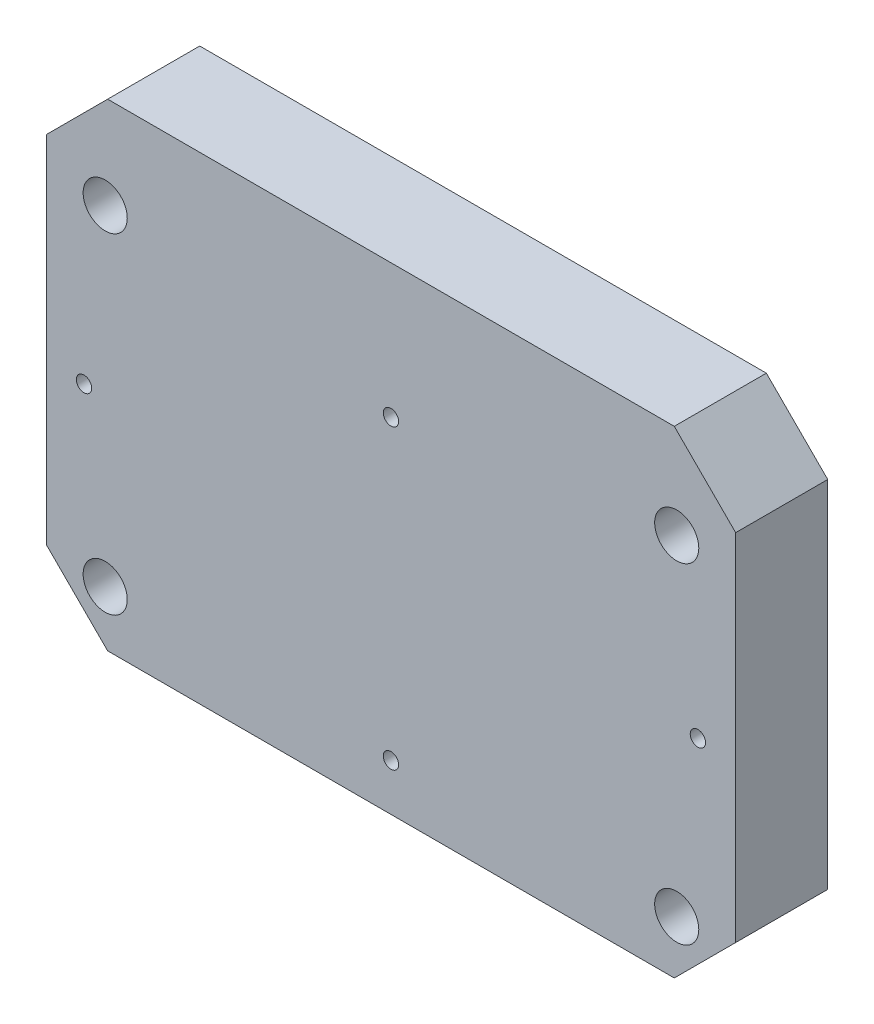
from build123d import *

# Parameters (mm, degrees)
SKETCH1_W                        = 142.628975504
SKETCH1_H                        = 98.843650928
BOSS_EXTRUDE1_DEPTH              = 19.05
CHAMFER1_SIZE                    = 12.7
F_23_64_0_35938_DIAMETER_HOLE1_D = 9.128252
HOLE1_D                          = 3.175
HOLE1_DEPTH                      = 44.45
HOLE1_CSINK_D                    = 10.16
HOLE1_CSINK_ANGLE                = 82
HOLE1_TIP                        = 0.953866233


with BuildPart() as part:
    # Sketch1 → Boss-Extrude1 (new body)
    with BuildSketch(Plane.XY):
        with Locations((0, 439.814227158)):
            Rectangle(SKETCH1_W, SKETCH1_H)
    extrude(amount=BOSS_EXTRUDE1_DEPTH)

    # Chamfer1
    chamfer1_edges = [part.edges().sort_by_distance(p)[0] for p in [
        (71.314487752, 390.392401694, 9.525),
        (-71.314487752, 390.392401694, 9.525),
        (-71.314487752, 489.236052622, 9.525),
        (71.314487752, 489.236052622, 9.525),
    ]]
    chamfer(chamfer1_edges, length=CHAMFER1_SIZE)

    # 23/64 (0.35938) Diameter Hole1 (through all)
    with Locations(Plane.XY.offset(19.05)):
        with Locations((-59.12, 469.942526688), (59.12, 469.942526688), (59.12, 401.616526688), (-59.12, 401.616526688)):
            Hole(F_23_64_0_35938_DIAMETER_HOLE1_D / 2)

    # Hole1
    with Locations(Plane(origin=(0, 0, -19.05), x_dir=(-1, 0, 0), z_dir=(0, 0, -1))):
        with Locations((63.5, 435.779526688), (-63.5, 435.779526688), (0, 461.558384256), (0, 400.075074406)):
            CounterSinkHole(HOLE1_D / 2, HOLE1_CSINK_D / 2, depth=HOLE1_DEPTH, counter_sink_angle=HOLE1_CSINK_ANGLE)
            with Locations((0, 0, -(HOLE1_DEPTH + HOLE1_TIP / 2))):  # 118° drill point
                Cone(0, HOLE1_D / 2, HOLE1_TIP, mode=Mode.SUBTRACT)


solid = part.part
